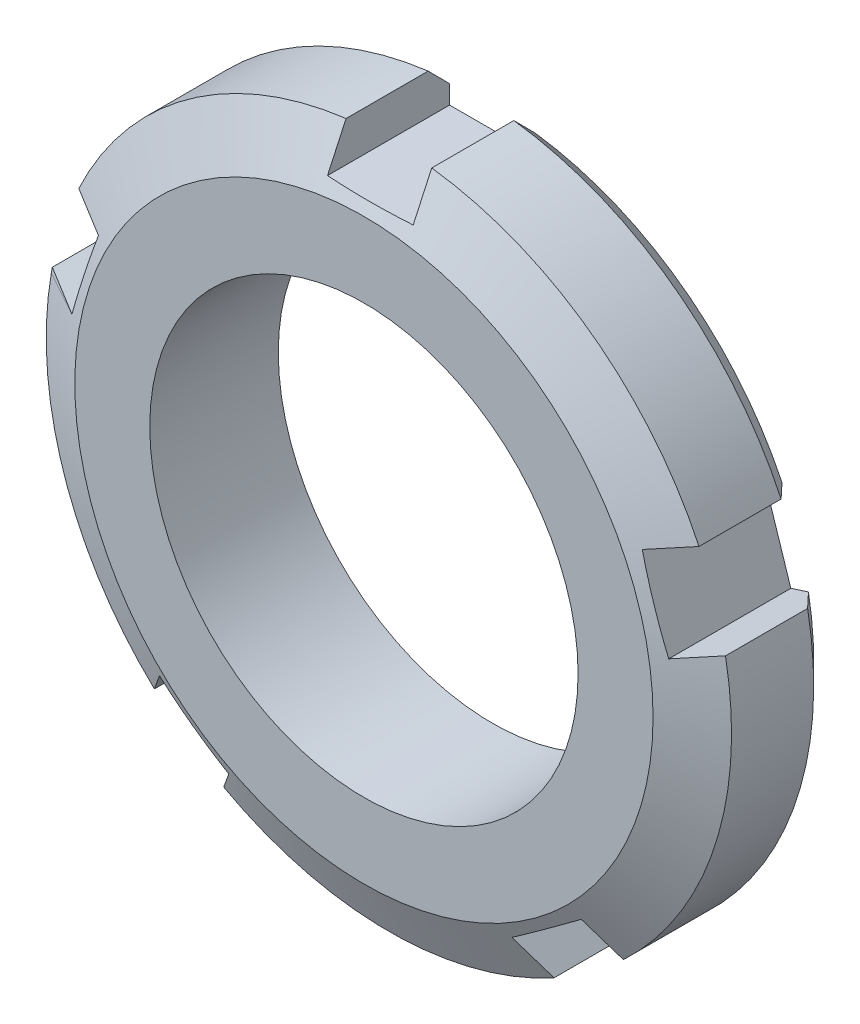
from build123d import *

# Parameters (mm, degrees)
SKETCH2_W          = 4
SKETCH2_H          = 2
CUT_EXTRUDE1_DEPTH = 24.409399821
CIRPATTERN1_COUNT  = 5


with BuildPart() as part:
    # Sketch1 → Revolve1 (revolve)
    with BuildSketch(Plane(origin=(0, 0, 0), x_dir=(0, 0, -1), z_dir=(1, 0, 0)), mode=Mode.PRIVATE) as revolve1_sk:
        Polygon((0, 10), (6, 10), (6, 15), (5, 16), (1.165769145, 16), (0, 13.5), align=None)
    revolve(revolve1_sk.sketch.rotate(Axis((0, 0, 16.345177665), (0, 0, -1)), 90), axis=Axis((0, 0, 16.345177665), (0, 0, -1)))

    # Sketch2 → Cut-Extrude1 (cut, through all)
    with BuildSketch(Plane.XY):
        with Locations((0, 15)):
            Rectangle(SKETCH2_W, SKETCH2_H)
    cut_extrude1 = extrude(amount=-CUT_EXTRUDE1_DEPTH, mode=Mode.SUBTRACT)

    # CirPattern1: Cut-Extrude1 ×5 about axis
    cirpattern1_axis = Axis((0, 0, 0), (0, 0, 1))
    for i in range(1, CIRPATTERN1_COUNT):
        add(cut_extrude1.rotate(cirpattern1_axis, i * 360 / CIRPATTERN1_COUNT), mode=Mode.SUBTRACT)


solid = part.part
